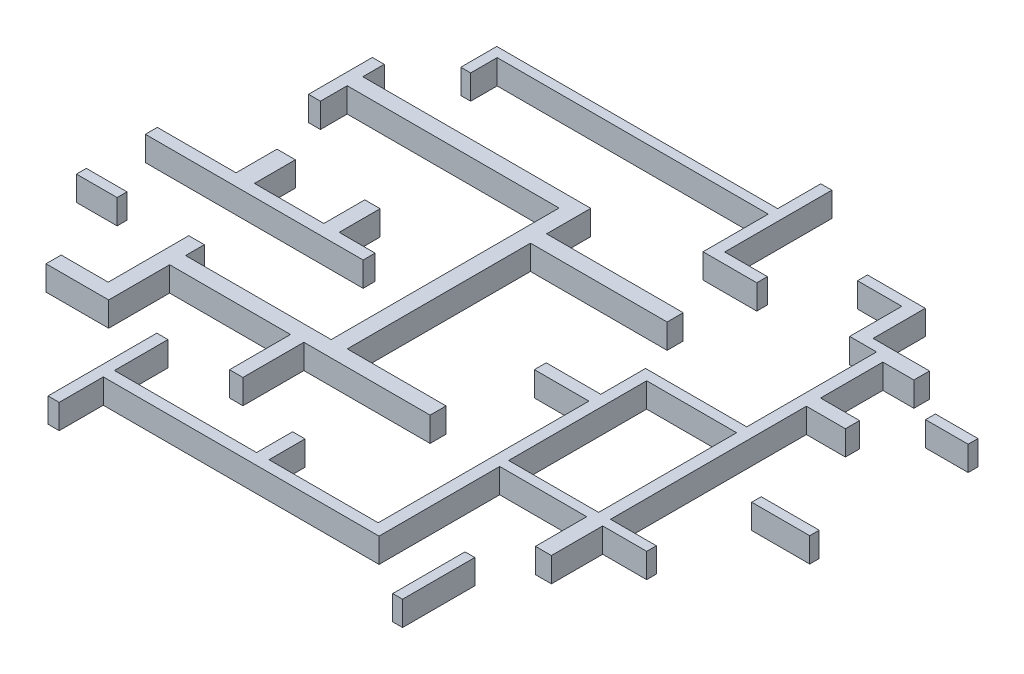
from build123d import *

# Parameters (mm, degrees)
BOSS_EXTRUDE1_DEPTH   = 1
SKETCH2_W             = 1.656127113
SKETCH2_H             = 0.403523357
BOSS_EXTRUDE1_2_DEPTH = 1
SKETCH2_W_2           = 0.399793695
SKETCH2_H_2           = 2.942071549
BOSS_EXTRUDE1_3_DEPTH = 1
SKETCH2_W_3           = 2.362778432
SKETCH2_H_3           = 0.387177978
BOSS_EXTRUDE1_4_DEPTH = 1
SKETCH2_W_4           = 1.734085152
SKETCH2_H_4           = 0.400598673
BOSS_EXTRUDE1_5_DEPTH = 1
SKETCH2_W_5           = 3.663039273
SKETCH2_H_5           = 5.619427971
BOSS_EXTRUDE1_6_DEPTH = 1
BOSS_EXTRUDE1_7_DEPTH = 1
BOSS_EXTRUDE1_8_DEPTH = 1


with BuildPart() as part:
    # Sketch2 → Boss-Extrude1 (new body)
    with BuildSketch(Plane(origin=(0, 0, 0), x_dir=(1, 0, 0), z_dir=(0, 1, 0))):
        Polygon((7.605464492, 22.6024559), (7.605464492, 23.681549605), (18.642776244, 23.681549605), (18.642776244, 21.02680261), (20.830931343, 21.02680261), (20.830931343, 21.461215754), (19.093278764, 21.461215754), (19.093278764, 25.821436577), (18.642776244, 25.821436577), (18.642776244, 24.067694623), (7.203230099, 24.067694623), (7.203230099, 22.6024559), align=None)
    extrude(amount=BOSS_EXTRUDE1_DEPTH)


with BuildPart() as body_2:
    # Sketch2 → Boss-Extrude1 2 (new body)
    with BuildSketch(Plane(origin=(0, 0, 0), x_dir=(1, 0, 0), z_dir=(0, 1, 0))):
        with Locations((3.974889679, 11.210373468)):
            Rectangle(SKETCH2_W, SKETCH2_H)
    extrude(amount=BOSS_EXTRUDE1_2_DEPTH)


with BuildPart() as body_3:
    # Sketch2 → Boss-Extrude1 3 (new body)
    with BuildSketch(Plane(origin=(0, 0, 0), x_dir=(1, 0, 0), z_dir=(0, 1, 0))):
        with Locations((24.57835525, 4.126838364)):
            Rectangle(SKETCH2_W_2, SKETCH2_H_2)
    extrude(amount=BOSS_EXTRUDE1_3_DEPTH)


with BuildPart() as body_4:
    # Sketch2 → Boss-Extrude1 4 (new body)
    with BuildSketch(Plane(origin=(0, 0, 0), x_dir=(1, 0, 0), z_dir=(0, 1, 0))):
        with Locations((29.647117733, 13.379675947)):
            Rectangle(SKETCH2_W_3, SKETCH2_H_3)
    extrude(amount=BOSS_EXTRUDE1_4_DEPTH)


with BuildPart() as body_5:
    # Sketch2 → Boss-Extrude1 5 (new body)
    with BuildSketch(Plane(origin=(0, 0, 0), x_dir=(1, 0, 0), z_dir=(0, 1, 0))):
        with Locations((29.961464373, 19.837437698)):
            Rectangle(SKETCH2_W_4, SKETCH2_H_4)
    extrude(amount=BOSS_EXTRUDE1_5_DEPTH)


with BuildPart() as body_6:
    # Sketch2 → Boss-Extrude1 6 (new body)
    with BuildSketch(Plane(origin=(0, 0, 0), x_dir=(1, 0, 0), z_dir=(0, 1, 0))):
        Polygon((22.809474168, 23.557509364), (22.809474168, 23.15038634), (24.613450326, 23.15038634), (24.613450326, 21.02680261), (25.708470873, 21.02680261), (25.708470873, 15.741512218), (21.587019629, 15.741512218), (21.587019629, 13.918871592), (19.364896126, 13.918871592), (19.364896126, 13.436163116), (21.587019629, 13.436163116), (21.587019629, 4.855603822), (17.139697437, 4.855603822), (17.139697437, 6.322792074), (16.634051986, 6.322792074), (16.634051986, 4.855603822), (10.845878767, 4.855603822), (10.845878767, 7.036958249), (10.391792573, 7.036958249), (10.391792573, 2.607794633), (10.845878767, 2.607794633), (10.845878767, 4.403168883), (22.074048821, 4.403168883), (22.074048821, 9.315093548), (25.618199821, 9.315093548), (25.618199821, 7.226429154), (26.267823787, 7.226429154), (26.267823787, 9.315093548), (28.060457007, 9.315093548), (28.060457007, 9.709107862), (26.193815993, 9.709107862), (26.193815993, 17.683798541), (27.783305254, 17.683798541), (27.783305254, 18.260117173), (26.193815993, 18.260117173), (26.193815993, 20.797383382), (27.457794112, 20.797383382), (27.457794112, 21.434253008), (25.160960599, 21.434253008), (25.160960599, 23.557509364), align=None)
        with Locations((23.876951237, 12.518821847)):
            Rectangle(SKETCH2_W_5, SKETCH2_H_5, mode=Mode.SUBTRACT)
    extrude(amount=BOSS_EXTRUDE1_6_DEPTH)


with BuildPart() as body_7:
    # Sketch2 → Boss-Extrude1 7 (new body)
    with BuildSketch(Plane(origin=(0, 0, 0), x_dir=(1, 0, 0), z_dir=(0, 1, 0))):
        Polygon((5.057728665, 21.146716907), (5.543695939, 21.146716907), (5.543695939, 20.271975814), (14.825670872, 20.271975814), (14.825670872, 18.4738969), (20.389996159, 18.4738969), (20.389996159, 17.81784108), (14.825670872, 17.81784108), (14.825670872, 10.358243425), (18.847050064, 10.358243425), (18.847050064, 9.709107862), (13.707946142, 9.709107862), (13.707946142, 7.226429154), (13.161232959, 7.226429154), (13.161232959, 9.709107862), (8.24081431, 9.709107862), (8.24081431, 7.226429154), (5.689486122, 7.226429154), (5.689486122, 7.843362782), (7.605464492, 7.843362782), (7.605464492, 11.123641881), (8.24081431, 11.123641881), (8.24081431, 10.358243425), (14.169615052, 10.358243425), (14.169615052, 19.637138361), (5.543695939, 19.637138361), (5.543695939, 18.546791991), (5.057728665, 18.546791991), align=None)
    extrude(amount=BOSS_EXTRUDE1_7_DEPTH)


with BuildPart() as body_8:
    # Sketch2 → Boss-Extrude1 8 (new body)
    with BuildSketch(Plane(origin=(0, 0, 0), x_dir=(1, 0, 0), z_dir=(0, 1, 0))):
        Polygon((3.146826122, 13.815189626), (12.013776669, 13.815189626), (12.013776669, 14.303194592), (10.549761771, 14.303194592), (10.549761771, 15.971490638), (9.925569373, 15.971490638), (9.925569373, 14.303194592), (7.099680151, 14.303194592), (7.099680151, 15.971490638), (6.350649274, 15.971490638), (6.350649274, 14.303194592), (3.146826122, 14.303194592), align=None)
    extrude(amount=BOSS_EXTRUDE1_8_DEPTH)


solid = Compound([part.part, body_2.part, body_3.part, body_4.part, body_5.part, body_6.part, body_7.part, body_8.part])
